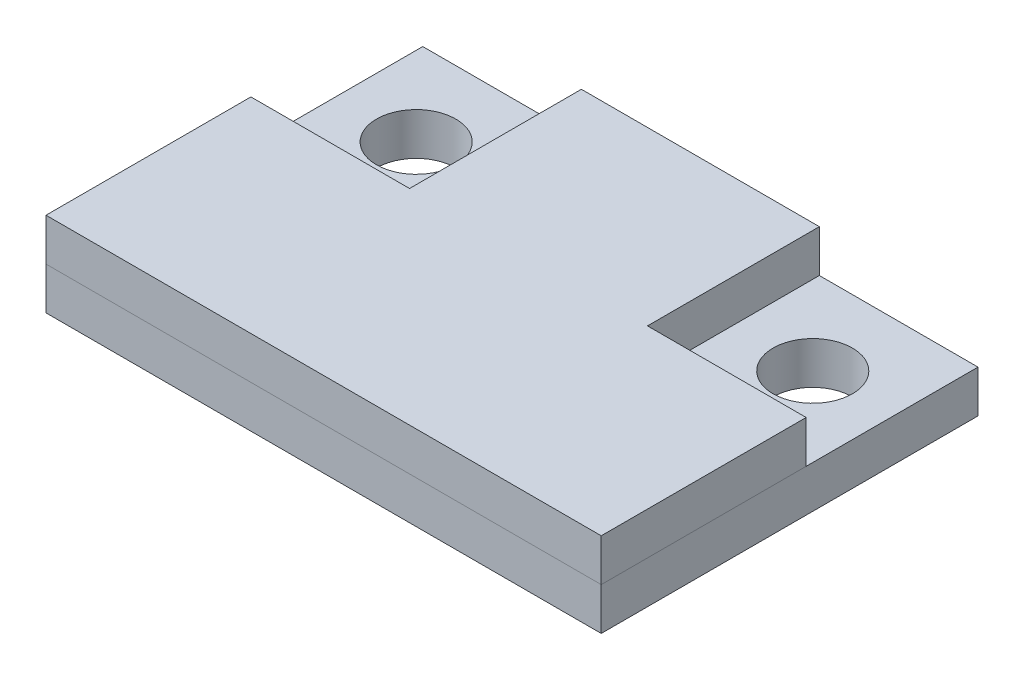
from build123d import *

# Parameters (mm, degrees)
SKETCH1_W           = 21
SKETCH1_H           = 14.25
SKETCH1_R           = 1.5
BOSS_EXTRUDE1_DEPTH = 1.6
BOSS_EXTRUDE2_DEPTH = 1.6


with BuildPart() as part:
    # Sketch1 → Boss-Extrude1 (new body)
    with BuildSketch(Plane(origin=(0, 0, 0), x_dir=(1, 0, 0), z_dir=(0, 1, 0))):
        Rectangle(SKETCH1_W, SKETCH1_H)
        with Locations(Location((-7.5, 3.875, 0), (0, 0, 270))):
            Circle(SKETCH1_R, mode=Mode.SUBTRACT)
        with Locations(Location((7.5, 3.875, 0), (0, 0, 270))):
            Circle(SKETCH1_R, mode=Mode.SUBTRACT)
    extrude(amount=-BOSS_EXTRUDE1_DEPTH)


with BuildPart() as body_2:
    # Sketch2 → Boss-Extrude2 (new body)
    with BuildSketch(Plane(origin=(0, 0, 0), x_dir=(1, 0, 0), z_dir=(0, 1, 0))):
        Polygon((-10.5, 0.625), (-4.5, 0.625), (-4.5, 7.125), (4.5, 7.125), (4.5, 0.625), (10.5, 0.625), (10.5, -7.125), (-10.5, -7.125), align=None)
    extrude(amount=BOSS_EXTRUDE2_DEPTH)


solid = Compound([part.part, body_2.part])
